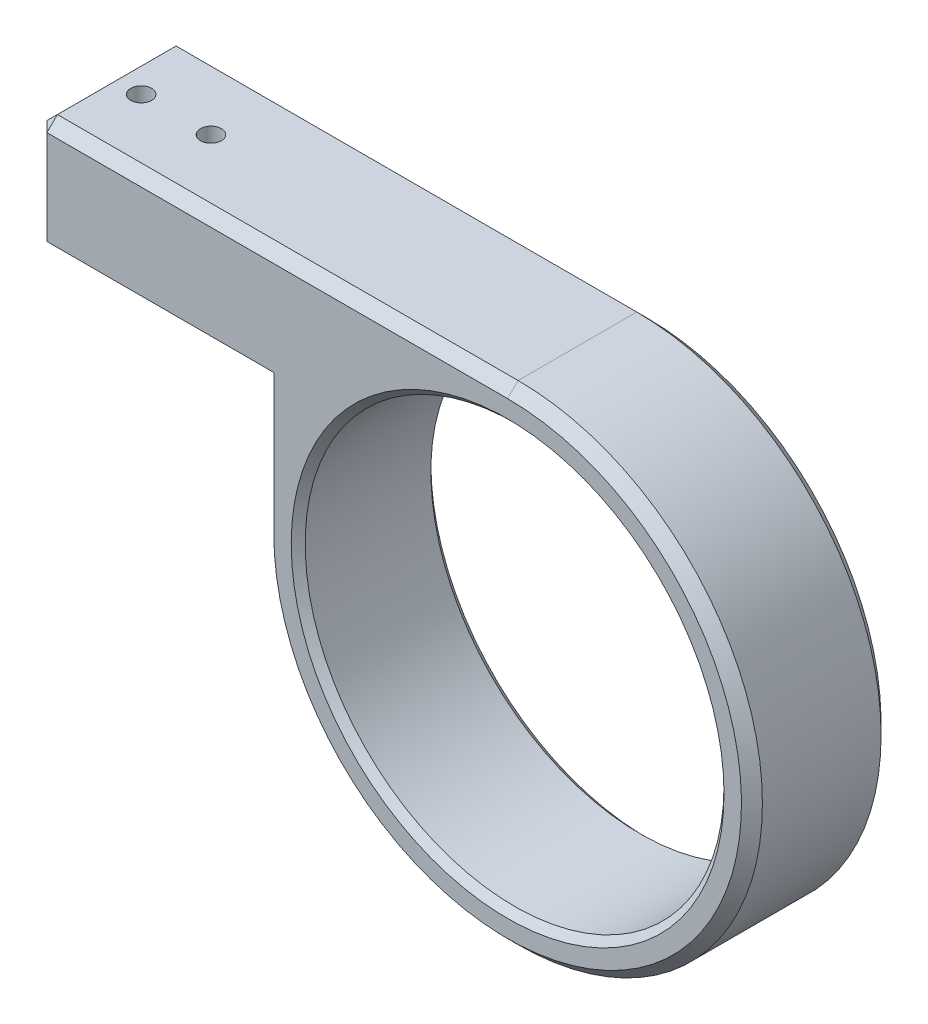
from build123d import *

# Parameters (mm, degrees)
SKETCH_1_R           = 35
EXTRUDE_1_DEPTH      = 20
SKETCH_2_R           = 30
CUT_EXTRUDE_1_DEPTH  = 54.38539126
EXTRUDE_2_REACH      = 82.777
EXTRUDE_2_END_RADIUS = 35
SKETCH_3_W           = 20
SKETCH_3_H           = 15
SKETCH_4_W           = 20
SKETCH_4_H           = 15
EXTRUDE_3_DEPTH      = 32.5
EXTRUDE_4_REACH      = 82.777
SKETCH_6_W           = 20
SKETCH_6_H           = 20
SKETCH_7_R           = 1.5
CUT_EXTRUDE_2_DEPTH  = 90.337841926
CHAMFER_1_SIZE       = 1
CHAMFER_2_SIZE       = 1.5


with BuildPart() as part:
    # 草图1 → 凸台-拉伸1 (new body)
    with BuildSketch(Plane.XY):
        Circle(SKETCH_1_R)
    extrude(amount=EXTRUDE_1_DEPTH)

    # 草图2 → 切除-拉伸1 (cut, through all)
    with BuildSketch(Plane(origin=(0, 0, 0), x_dir=(-1, 0, 0), z_dir=(0, 0, -1))):
        Circle(SKETCH_2_R)
    extrude(amount=-CUT_EXTRUDE_1_DEPTH, mode=Mode.SUBTRACT)

    # 凸台-拉伸2: up to this cylinder (the profile starts outside it)
    extrude_2_end = Plane(origin=(0, 0, 10), z_dir=(0, 0, -1)) * Cylinder(EXTRUDE_2_END_RADIUS, 236.554, mode=Mode.PRIVATE)
    # 草图3 → 凸台-拉伸2 (add, up to the surface)
    with BuildSketch(Plane.ZY.offset(35), mode=Mode.PRIVATE) as extrude_2_sk1:
        with Locations((10, 27.5)):
            Rectangle(SKETCH_3_W, SKETCH_3_H)
    extrude_2_tool1 = extrude(extrude_2_sk1.sketch, amount=-EXTRUDE_2_REACH, mode=Mode.PRIVATE) - extrude_2_end
    add(extrude_2_tool1.solids().sort_by_distance((-35, 27.5, 10))[0])

    # 草图4 → 凸台-拉伸3 (add)
    with BuildSketch(Plane.ZY.offset(35)):
        with Locations((10, 27.5)):
            Rectangle(SKETCH_4_W, SKETCH_4_H)
    extrude(amount=EXTRUDE_3_DEPTH)

    # 草图6 → 凸台-拉伸4 (add, up to next)
    with BuildSketch(Plane.ZY.offset(35), mode=Mode.PRIVATE) as extrude_4_sk1:
        with Locations((10, 10)):
            Rectangle(SKETCH_6_W, SKETCH_6_H)
    extrude_4_tool1 = extrude(extrude_4_sk1.sketch, amount=-EXTRUDE_4_REACH, mode=Mode.PRIVATE) - part.part
    add(extrude_4_tool1.solids().sort_by_distance((-35, 10, 10))[0])

    # 草图7 → 切除-拉伸2 (cut, through all)
    with BuildSketch(Plane.XZ.offset(-20)):
        with Locations(Location((-62.5, 10, 0), (0, 0, 270))):
            Circle(SKETCH_7_R)
        with Locations(Location((-52.5, 10, 0), (0, 0, 270))):
            Circle(SKETCH_7_R)
    extrude(amount=-CUT_EXTRUDE_2_DEPTH, mode=Mode.SUBTRACT)

    # 倒角1
    chamfer_1_edges = [part.edges().sort_by_distance(p)[0] for p in [
        (30, 0, 20),
        (30, 0, 0),
    ]]
    chamfer(chamfer_1_edges, length=CHAMFER_1_SIZE)

    # 倒角2
    chamfer_2_edges = [part.edges().sort_by_distance(p)[0] for p in [
        (-33.75, 35, 20),
        (-33.75, 35, 0),
        (-67.5, 27.5, 0),
        (-67.5, 27.5, 20),
        (-67.5, 35, 10),
        (24.748737342, -24.748737342, 0),
        (24.748737342, -24.748737342, 20),
        (-35, 10, 0),
        (-35, 10, 20),
    ]]
    chamfer(chamfer_2_edges, length=CHAMFER_2_SIZE)


solid = part.part
